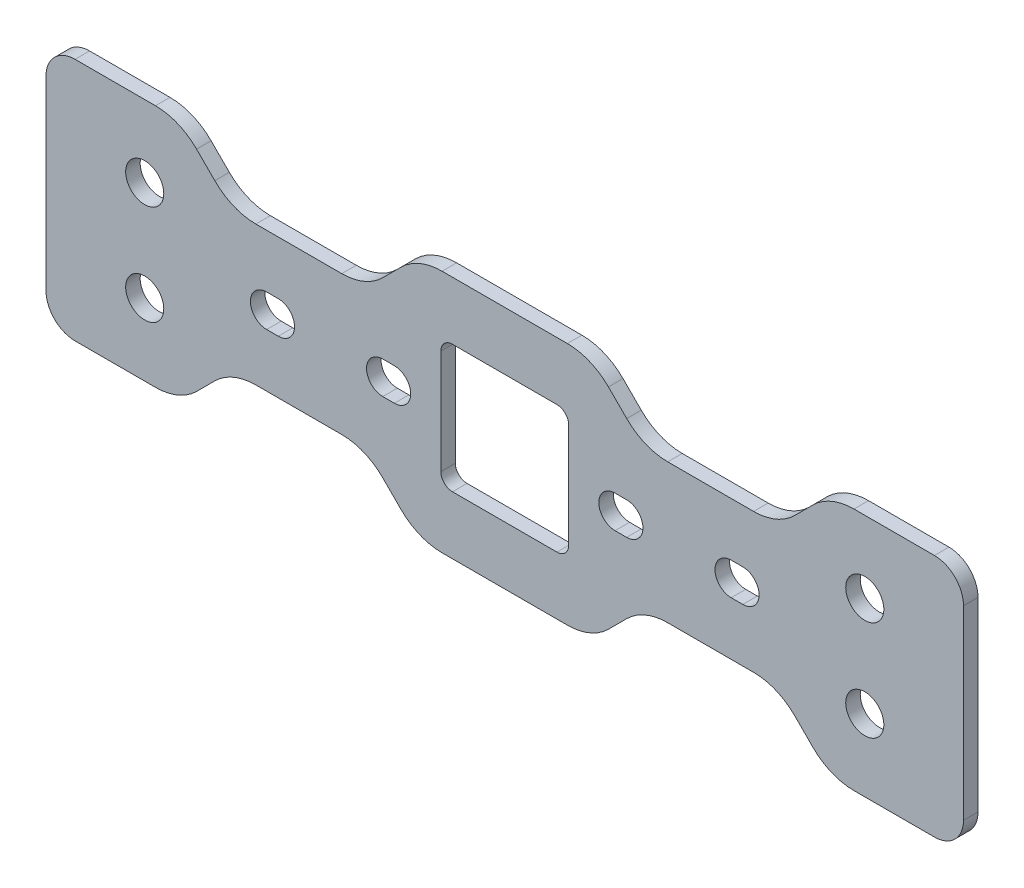
from build123d import *

# Parameters (mm, degrees)
SKETCH1_R           = 4.1656
BOSS_EXTRUDE1_DEPTH = 3.175
CUT_EXTRUDE2_DEPTH  = 104.862786526
FILLET1_R           = 12.7


with BuildPart() as part:
    # Sketch1 → Boss-Extrude1 (new body)
    with BuildSketch(Plane.XY):
        with BuildLine():
            Line((-93.98, 26.67), (93.98, 26.67))
            ThreePointArc((93.98, 26.67), (98.470128061, 24.810128061), (100.33, 20.32))
            Line((100.33, 20.32), (100.33, -20.32))
            ThreePointArc((100.33, -20.32), (98.470128061, -24.810128061), (93.98, -26.67))
            Line((93.98, -26.67), (-93.98, -26.67))
            ThreePointArc((-93.98, -26.67), (-98.470128061, -24.810128061), (-100.33, -20.32))
            Line((-100.33, -20.32), (-100.33, 20.32))
            ThreePointArc((-100.33, 20.32), (-98.470128061, 24.810128061), (-93.98, 26.67))
        make_face()
        with Locations((-78.74, 10.922)):
            Circle(SKETCH1_R, mode=Mode.SUBTRACT)
        with Locations((-78.74, -10.922)):
            Circle(SKETCH1_R, mode=Mode.SUBTRACT)
        with Locations(Location((78.74, -10.922, 0), (0, 0, 180))):
            Circle(SKETCH1_R, mode=Mode.SUBTRACT)
        with Locations(Location((78.74, 10.922, 0), (0, 0, 180))):
            Circle(SKETCH1_R, mode=Mode.SUBTRACT)
        with BuildLine():
            Line((-11.43, 13.97), (11.43, 13.97))
            ThreePointArc((11.43, 13.97), (13.226051224, 13.226051224), (13.97, 11.43))
            Line((13.97, 11.43), (13.97, -11.43))
            ThreePointArc((13.97, -11.43), (13.226051224, -13.226051224), (11.43, -13.97))
            Line((11.43, -13.97), (-11.43, -13.97))
            ThreePointArc((-11.43, -13.97), (-13.226051224, -13.226051224), (-13.97, -11.43))
            Line((-13.97, -11.43), (-13.97, 11.43))
            ThreePointArc((-13.97, 11.43), (-13.226051224, 13.226051224), (-11.43, 13.97))
        make_face(mode=Mode.SUBTRACT)
        with BuildLine():
            Line((-52.07, 3.556), (-49.53, 3.556))
            ThreePointArc((-49.53, 3.556), (-45.974, 0), (-49.53, -3.556))
            Line((-49.53, -3.556), (-52.07, -3.556))
            ThreePointArc((-52.07, -3.556), (-55.626, 0), (-52.07, 3.556))
        make_face(mode=Mode.SUBTRACT)
        with BuildLine():
            Line((-26.67, 3.556), (-24.13, 3.556))
            ThreePointArc((-24.13, 3.556), (-20.574, 0), (-24.13, -3.556))
            Line((-24.13, -3.556), (-26.67, -3.556))
            ThreePointArc((-26.67, -3.556), (-30.226, 0), (-26.67, 3.556))
        make_face(mode=Mode.SUBTRACT)
        with BuildLine():
            Line((26.67, 3.556), (24.13, 3.556))
            ThreePointArc((24.13, 3.556), (20.574, 0), (24.13, -3.556))
            Line((24.13, -3.556), (26.67, -3.556))
            ThreePointArc((26.67, -3.556), (30.226, 0), (26.67, 3.556))
        make_face(mode=Mode.SUBTRACT)
        with BuildLine():
            Line((52.07, 3.556), (49.53, 3.556))
            ThreePointArc((49.53, 3.556), (45.974, 0), (49.53, -3.556))
            Line((49.53, -3.556), (52.07, -3.556))
            ThreePointArc((52.07, -3.556), (55.626, 0), (52.07, 3.556))
        make_face(mode=Mode.SUBTRACT)
    extrude(amount=BOSS_EXTRUDE1_DEPTH)

    # Sketch3 → Cut-Extrude2 (cut, through all)
    with BuildSketch(Plane.XY):
        with BuildLine():
            Line((-71.12, 26.67), (-63.409743879, 18.959743879))
            ThreePointArc((-63.409743879, 18.959743879), (-59.289567349, 16.206729937), (-54.429487758, 15.24))
            Line((-54.429487758, 15.24), (-35.650256121, 15.24))
            ThreePointArc((-35.650256121, 15.24), (-30.79017653, 16.206729937), (-26.67, 18.959743879))
            Line((-26.67, 18.959743879), (-18.959743879, 26.67))
            Line((-18.959743879, 26.67), (-71.12, 26.67))
        make_face()
        with BuildLine():
            Line((-71.12, -26.67), (-18.959743879, -26.67))
            Line((-18.959743879, -26.67), (-26.67, -18.959743879))
            ThreePointArc((-26.67, -18.959743879), (-30.79017653, -16.206729937), (-35.650256121, -15.24))
            Line((-35.650256121, -15.24), (-54.429487758, -15.24))
            ThreePointArc((-54.429487758, -15.24), (-59.289567349, -16.206729937), (-63.409743879, -18.959743879))
            Line((-63.409743879, -18.959743879), (-71.12, -26.67))
        make_face()
        with BuildLine():
            Line((71.12, -26.67), (63.409743879, -18.959743879))
            ThreePointArc((63.409743879, -18.959743879), (59.289567349, -16.206729937), (54.429487758, -15.24))
            Line((54.429487758, -15.24), (35.650256121, -15.24))
            ThreePointArc((35.650256121, -15.24), (30.79017653, -16.206729937), (26.67, -18.959743879))
            Line((26.67, -18.959743879), (18.959743879, -26.67))
            Line((18.959743879, -26.67), (71.12, -26.67))
        make_face()
        with BuildLine():
            Line((71.12, 26.67), (18.959743879, 26.67))
            Line((18.959743879, 26.67), (26.67, 18.959743879))
            ThreePointArc((26.67, 18.959743879), (30.79017653, 16.206729937), (35.650256121, 15.24))
            Line((35.650256121, 15.24), (54.429487758, 15.24))
            ThreePointArc((54.429487758, 15.24), (59.289567349, 16.206729937), (63.409743879, 18.959743879))
            Line((63.409743879, 18.959743879), (71.12, 26.67))
        make_face()
    extrude(amount=CUT_EXTRUDE2_DEPTH, mode=Mode.SUBTRACT)

    # Fillet1
    fillet1_edges = [part.edges().sort_by_distance(p)[0] for p in [
        (-18.959743879, 26.67, 1.5875),
        (-71.12, 26.67, 1.5875),
        (-71.12, -26.67, 1.5875),
        (-18.959743879, -26.67, 1.5875),
        (71.12, 26.67, 1.5875),
        (18.959743879, 26.67, 1.5875),
        (18.959743879, -26.67, 1.5875),
        (71.12, -26.67, 1.5875),
    ]]
    fillet(fillet1_edges, radius=FILLET1_R)


solid = part.part
